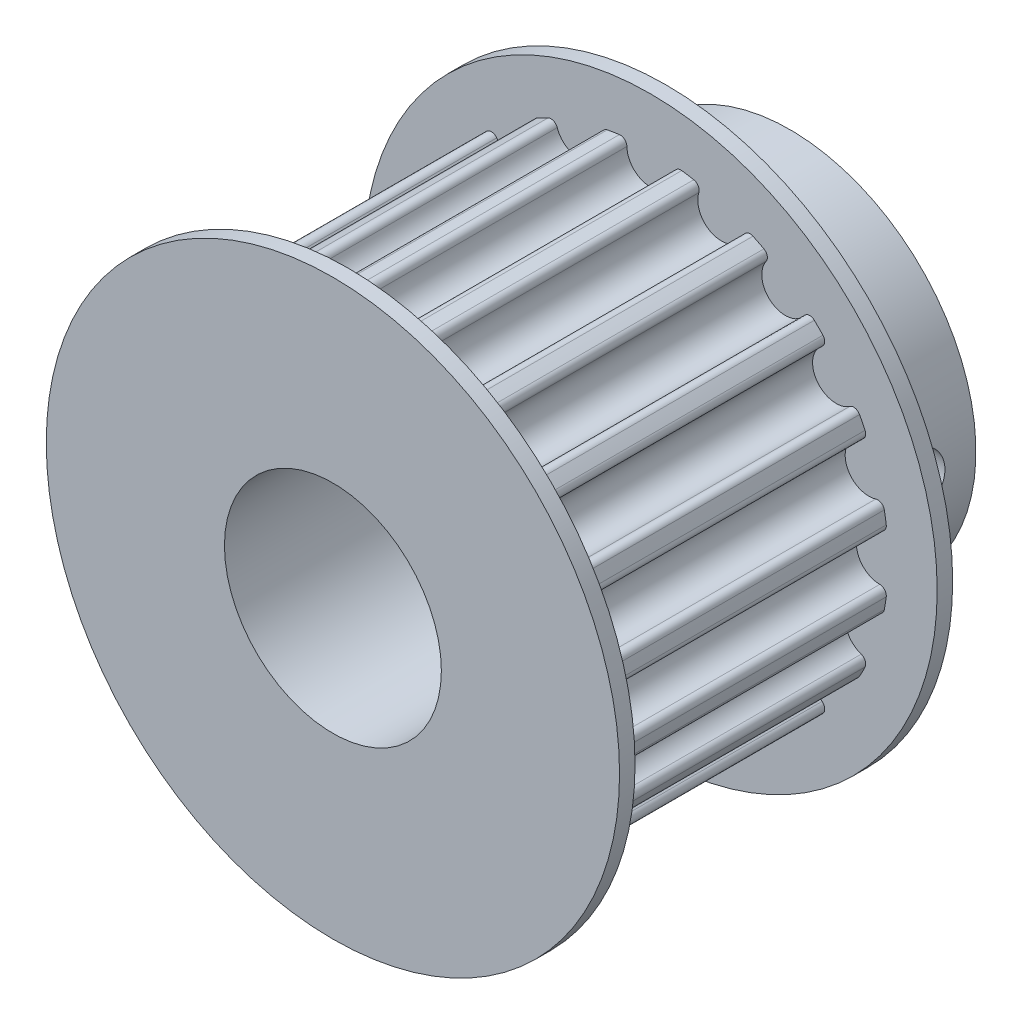
from build123d import *

# Parameters (mm, degrees)
BOSS_EXTRUDE1_DEPTH = 19.5
SKETCH2_R           = 18.5
BOSS_EXTRUDE2_DEPTH = 1
SKETCH3_R           = 12
BOSS_EXTRUDE3_DEPTH = 8
SKETCH4_R           = 7
CUT_EXTRUDE1_DEPTH  = 40.430318284
SKETCH5_R           = 2
CUT_EXTRUDE2_DEPTH  = 34.237779709
CIRPATTERN1_COUNT   = 2
CIRPATTERN1_ANGLE   = 90


with BuildPart() as part:
    # Sketch1 → Boss-Extrude1 (new body)
    with BuildSketch(Plane.XY):
        with BuildLine():
            ThreePointArc((0, 13.285), (1.071791943, 13.725155757), (1.524888287, 14.791541599))
            ThreePointArc((1.524888287, 14.791541599), (1.673388423, 15.111414709), (2.011215381, 15.212627574))
            ThreePointArc((2.011215381, 15.212627574), (2.400486866, 15.156077586), (2.788180956, 15.089568316))
            ThreePointArc((2.788180956, 15.089568316), (3.07819699, 14.888914891), (3.120582785, 14.538808418))
            ThreePointArc((3.120582785, 14.538808418), (3.221971668, 13.384600745), (4.10529077, 12.634785819))
            ThreePointArc((4.10529077, 12.634785819), (5.260641091, 12.722196895), (6.021092669, 13.596375628))
            ThreePointArc((6.021092669, 13.596375628), (6.261170918, 13.854703969), (6.613739943, 13.846568852))
            ThreePointArc((6.613739943, 13.846568852), (6.966484219, 13.672495114), (7.314650714, 13.489436976))
            ThreePointArc((7.314650714, 13.489436976), (7.528467035, 13.208984345), (7.460589472, 12.862915373))
            ThreePointArc((7.460589472, 12.862915373), (7.200346243, 11.733867756), (7.808727077, 10.74779077))
            ThreePointArc((7.808727077, 10.74779077), (8.934542036, 10.47390076), (9.927910549, 11.07030168))
            ThreePointArc((9.927910549, 11.07030168), (10.23606638, 11.241798273), (10.568865559, 11.125111496))
            ThreePointArc((10.568865559, 11.125111496), (10.850553557, 10.850553557), (11.125111496, 10.568865559))
            ThreePointArc((11.125111496, 10.568865559), (11.241798273, 10.23606638), (11.07030168, 9.927910549))
            ThreePointArc((11.07030168, 9.927910549), (10.47390076, 8.934542036), (10.74779077, 7.808727077))
            ThreePointArc((10.74779077, 7.808727077), (11.733867756, 7.200346243), (12.862915373, 7.460589472))
            ThreePointArc((12.862915373, 7.460589472), (13.208984345, 7.528467035), (13.489436976, 7.314650714))
            ThreePointArc((13.489436976, 7.314650714), (13.672495114, 6.966484219), (13.846568852, 6.613739943))
            ThreePointArc((13.846568852, 6.613739943), (13.854703969, 6.261170918), (13.596375628, 6.021092669))
            ThreePointArc((13.596375628, 6.021092669), (12.722196895, 5.260641091), (12.634785819, 4.10529077))
            ThreePointArc((12.634785819, 4.10529077), (13.384600745, 3.221971668), (14.538808418, 3.120582785))
            ThreePointArc((14.538808418, 3.120582785), (14.888914891, 3.07819699), (15.089568316, 2.788180956))
            ThreePointArc((15.089568316, 2.788180956), (15.156077586, 2.400486866), (15.212627574, 2.011215381))
            ThreePointArc((15.212627574, 2.011215381), (15.111414709, 1.673388423), (14.791541599, 1.524888287))
            ThreePointArc((14.791541599, 1.524888287), (13.725155757, 1.071791943), (13.285, 0))
            ThreePointArc((13.285, 0), (13.725155757, -1.071791943), (14.791541599, -1.524888287))
            ThreePointArc((14.791541599, -1.524888287), (15.111414709, -1.673388423), (15.212627574, -2.011215381))
            ThreePointArc((15.212627574, -2.011215381), (15.156077586, -2.400486866), (15.089568316, -2.788180956))
            ThreePointArc((15.089568316, -2.788180956), (14.888914891, -3.07819699), (14.538808418, -3.120582785))
            ThreePointArc((14.538808418, -3.120582785), (13.384600745, -3.221971668), (12.634785819, -4.10529077))
            ThreePointArc((12.634785819, -4.10529077), (12.722196895, -5.260641091), (13.596375628, -6.021092669))
            ThreePointArc((13.596375628, -6.021092669), (13.854703969, -6.261170918), (13.846568852, -6.613739943))
            ThreePointArc((13.846568852, -6.613739943), (13.672495114, -6.966484219), (13.489436976, -7.314650714))
            ThreePointArc((13.489436976, -7.314650714), (13.208984345, -7.528467035), (12.862915373, -7.460589472))
            ThreePointArc((12.862915373, -7.460589472), (11.733867756, -7.200346243), (10.74779077, -7.808727077))
            ThreePointArc((10.74779077, -7.808727077), (10.47390076, -8.934542036), (11.07030168, -9.927910549))
            ThreePointArc((11.07030168, -9.927910549), (11.241798273, -10.23606638), (11.125111496, -10.568865559))
            ThreePointArc((11.125111496, -10.568865559), (10.850553557, -10.850553557), (10.568865559, -11.125111496))
            ThreePointArc((10.568865559, -11.125111496), (10.23606638, -11.241798273), (9.927910549, -11.07030168))
            ThreePointArc((9.927910549, -11.07030168), (8.934542036, -10.47390076), (7.808727077, -10.74779077))
            ThreePointArc((7.808727077, -10.74779077), (7.200346243, -11.733867756), (7.460589472, -12.862915373))
            ThreePointArc((7.460589472, -12.862915373), (7.528467035, -13.208984345), (7.314650714, -13.489436976))
            ThreePointArc((7.314650714, -13.489436976), (6.966484219, -13.672495114), (6.613739943, -13.846568852))
            ThreePointArc((6.613739943, -13.846568852), (6.261170918, -13.854703969), (6.021092669, -13.596375628))
            ThreePointArc((6.021092669, -13.596375628), (5.260641091, -12.722196895), (4.10529077, -12.634785819))
            ThreePointArc((4.10529077, -12.634785819), (3.221971668, -13.384600745), (3.120582785, -14.538808418))
            ThreePointArc((3.120582785, -14.538808418), (3.07819699, -14.888914891), (2.788180956, -15.089568316))
            ThreePointArc((2.788180956, -15.089568316), (2.400486866, -15.156077586), (2.011215381, -15.212627574))
            ThreePointArc((2.011215381, -15.212627574), (1.673388423, -15.111414709), (1.524888287, -14.791541599))
            ThreePointArc((1.524888287, -14.791541599), (1.071791943, -13.725155757), (0, -13.285))
            ThreePointArc((0, -13.285), (-1.071791943, -13.725155757), (-1.524888287, -14.791541599))
            ThreePointArc((-1.524888287, -14.791541599), (-1.673388423, -15.111414709), (-2.011215381, -15.212627574))
            ThreePointArc((-2.011215381, -15.212627574), (-2.400486866, -15.156077586), (-2.788180956, -15.089568316))
            ThreePointArc((-2.788180956, -15.089568316), (-3.07819699, -14.888914891), (-3.120582785, -14.538808418))
            ThreePointArc((-3.120582785, -14.538808418), (-3.221971668, -13.384600745), (-4.10529077, -12.634785819))
            ThreePointArc((-4.10529077, -12.634785819), (-5.260641091, -12.722196895), (-6.021092669, -13.596375628))
            ThreePointArc((-6.021092669, -13.596375628), (-6.261170918, -13.854703969), (-6.613739943, -13.846568852))
            ThreePointArc((-6.613739943, -13.846568852), (-6.966484219, -13.672495114), (-7.314650714, -13.489436976))
            ThreePointArc((-7.314650714, -13.489436976), (-7.528467035, -13.208984345), (-7.460589472, -12.862915373))
            ThreePointArc((-7.460589472, -12.862915373), (-7.200346243, -11.733867756), (-7.808727077, -10.74779077))
            ThreePointArc((-7.808727077, -10.74779077), (-8.934542036, -10.47390076), (-9.927910549, -11.07030168))
            ThreePointArc((-9.927910549, -11.07030168), (-10.23606638, -11.241798273), (-10.568865559, -11.125111496))
            ThreePointArc((-10.568865559, -11.125111496), (-10.850553557, -10.850553557), (-11.125111496, -10.568865559))
            ThreePointArc((-11.125111496, -10.568865559), (-11.241798273, -10.23606638), (-11.07030168, -9.927910549))
            ThreePointArc((-11.07030168, -9.927910549), (-10.47390076, -8.934542036), (-10.74779077, -7.808727077))
            ThreePointArc((-10.74779077, -7.808727077), (-11.733867756, -7.200346243), (-12.862915373, -7.460589472))
            ThreePointArc((-12.862915373, -7.460589472), (-13.208984345, -7.528467035), (-13.489436976, -7.314650714))
            ThreePointArc((-13.489436976, -7.314650714), (-13.672495114, -6.966484219), (-13.846568852, -6.613739943))
            ThreePointArc((-13.846568852, -6.613739943), (-13.854703969, -6.261170918), (-13.596375628, -6.021092669))
            ThreePointArc((-13.596375628, -6.021092669), (-12.722196895, -5.260641091), (-12.634785819, -4.10529077))
            ThreePointArc((-12.634785819, -4.10529077), (-13.384600745, -3.221971668), (-14.538808418, -3.120582785))
            ThreePointArc((-14.538808418, -3.120582785), (-14.888914891, -3.07819699), (-15.089568316, -2.788180956))
            ThreePointArc((-15.089568316, -2.788180956), (-15.156077586, -2.400486866), (-15.212627574, -2.011215381))
            ThreePointArc((-15.212627574, -2.011215381), (-15.111414709, -1.673388423), (-14.791541599, -1.524888287))
            ThreePointArc((-14.791541599, -1.524888287), (-13.725155757, -1.071791943), (-13.285, 0))
            ThreePointArc((-13.285, 0), (-13.725155757, 1.071791943), (-14.791541599, 1.524888287))
            ThreePointArc((-14.791541599, 1.524888287), (-15.111414709, 1.673388423), (-15.212627574, 2.011215381))
            ThreePointArc((-15.212627574, 2.011215381), (-15.156077586, 2.400486866), (-15.089568316, 2.788180956))
            ThreePointArc((-15.089568316, 2.788180956), (-14.888914891, 3.07819699), (-14.538808418, 3.120582785))
            ThreePointArc((-14.538808418, 3.120582785), (-13.384600745, 3.221971668), (-12.634785819, 4.10529077))
            ThreePointArc((-12.634785819, 4.10529077), (-12.722196895, 5.260641091), (-13.596375628, 6.021092669))
            ThreePointArc((-13.596375628, 6.021092669), (-13.854703969, 6.261170918), (-13.846568852, 6.613739943))
            ThreePointArc((-13.846568852, 6.613739943), (-13.672495114, 6.966484219), (-13.489436976, 7.314650714))
            ThreePointArc((-13.489436976, 7.314650714), (-13.208984345, 7.528467035), (-12.862915373, 7.460589472))
            ThreePointArc((-12.862915373, 7.460589472), (-11.733867756, 7.200346243), (-10.74779077, 7.808727077))
            ThreePointArc((-10.74779077, 7.808727077), (-10.47390076, 8.934542036), (-11.07030168, 9.927910549))
            ThreePointArc((-11.07030168, 9.927910549), (-11.241798273, 10.23606638), (-11.125111496, 10.568865559))
            ThreePointArc((-11.125111496, 10.568865559), (-10.850553557, 10.850553557), (-10.568865559, 11.125111496))
            ThreePointArc((-10.568865559, 11.125111496), (-10.23606638, 11.241798273), (-9.927910549, 11.07030168))
            ThreePointArc((-9.927910549, 11.07030168), (-8.934542036, 10.47390076), (-7.808727077, 10.74779077))
            ThreePointArc((-7.808727077, 10.74779077), (-7.200346243, 11.733867756), (-7.460589472, 12.862915373))
            ThreePointArc((-7.460589472, 12.862915373), (-7.528467035, 13.208984345), (-7.314650714, 13.489436976))
            ThreePointArc((-7.314650714, 13.489436976), (-6.966484219, 13.672495114), (-6.613739943, 13.846568852))
            ThreePointArc((-6.613739943, 13.846568852), (-6.261170918, 13.854703969), (-6.021092669, 13.596375628))
            ThreePointArc((-6.021092669, 13.596375628), (-5.260641091, 12.722196895), (-4.10529077, 12.634785819))
            ThreePointArc((-4.10529077, 12.634785819), (-3.221971668, 13.384600745), (-3.120582785, 14.538808418))
            ThreePointArc((-3.120582785, 14.538808418), (-3.07819699, 14.888914891), (-2.788180956, 15.089568316))
            ThreePointArc((-2.788180956, 15.089568316), (-2.400486866, 15.156077586), (-2.011215381, 15.212627574))
            ThreePointArc((-2.011215381, 15.212627574), (-1.673388423, 15.111414709), (-1.524888287, 14.791541599))
            ThreePointArc((-1.524888287, 14.791541599), (-1.071791943, 13.725155757), (0, 13.285))
        make_face()
    extrude(amount=BOSS_EXTRUDE1_DEPTH)

    # Sketch2 → Boss-Extrude2 (add)
    with BuildSketch(Plane(origin=(0, 0, 0), x_dir=(-1, 0, 0), z_dir=(0, 0, -1))):
        Circle(SKETCH2_R)
    boss_extrude2 = extrude(amount=BOSS_EXTRUDE2_DEPTH)

    # Mirror1: Boss-Extrude2 across plane
    add(boss_extrude2.mirror(Plane.XY.offset(9.75)))

    # Sketch3 → Boss-Extrude3 (add)
    with BuildSketch(Plane(origin=(0, 0, -1), x_dir=(-1, 0, 0), z_dir=(0, 0, -1))):
        Circle(SKETCH3_R)
    extrude(amount=BOSS_EXTRUDE3_DEPTH)

    # Sketch4 → Cut-Extrude1 (cut, through all)
    with BuildSketch(Plane(origin=(0, 0, -9), x_dir=(-1, 0, 0), z_dir=(0, 0, -1))):
        Circle(SKETCH4_R)
    extrude(amount=-CUT_EXTRUDE1_DEPTH, mode=Mode.SUBTRACT)

    # Sketch5 → Cut-Extrude2 (cut, through all)
    with BuildSketch(Plane(origin=(0, 0, 0), x_dir=(1, 0, 0), z_dir=(0, 1, 0))):
        with Locations(Location((0, 5, 0), (0, 0, 270))):
            Circle(SKETCH5_R)
    cut_extrude2 = extrude(amount=-CUT_EXTRUDE2_DEPTH, mode=Mode.SUBTRACT)

    # CirPattern1: Cut-Extrude2 ×2 about axis
    cirpattern1_axis = Axis((0, 0, -9), (0, 0, 1))
    for i in range(1, CIRPATTERN1_COUNT):
        add(cut_extrude2.rotate(cirpattern1_axis, i * CIRPATTERN1_ANGLE / (CIRPATTERN1_COUNT - 1)), mode=Mode.SUBTRACT)


solid = part.part
